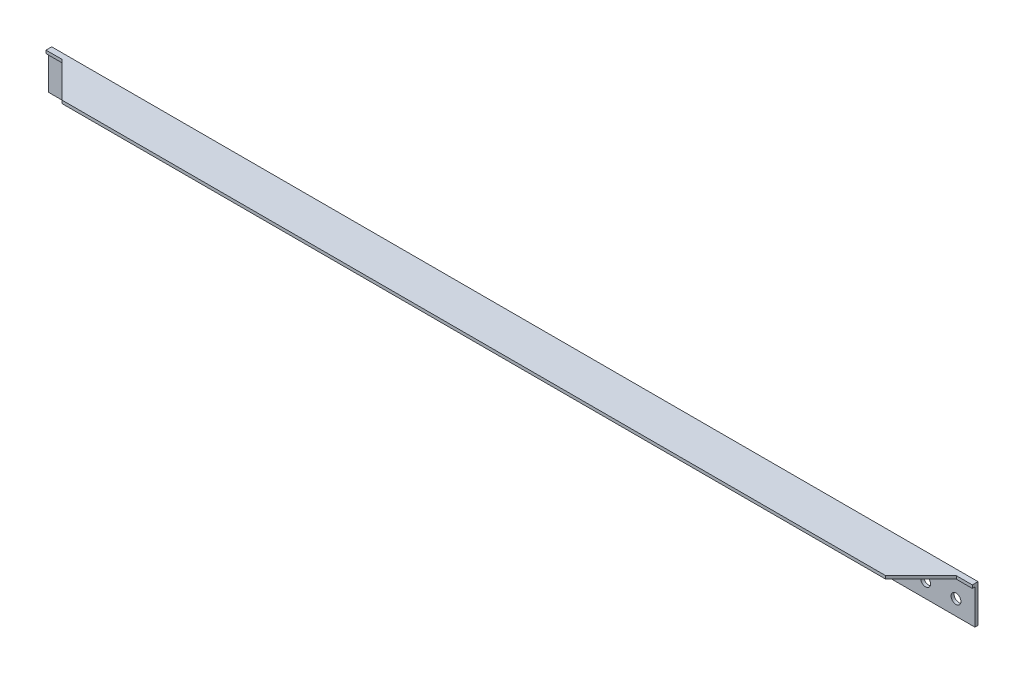
from build123d import *

# Parameters (mm, degrees)
SKETCH_1_W          = 2440
SKETCH_1_H          = 100
SKETCH_1_R          = 13
EXTRUDE_694_DEPTH   = 8
SKETCH_2_W          = 2440
SKETCH_2_H          = 8
EXTRUDE_1_DEPTH     = 100
CUT_EXTRUDE_1_DEPTH = 1229.846613699


with BuildPart() as part:
    # 草图1 → Extrude 694 (new body)
    with BuildSketch(Plane.XY):
        with Locations((0, 50)):
            Rectangle(SKETCH_1_W, SKETCH_1_H)
        with Locations((1090, 40)):
            Circle(SKETCH_1_R, mode=Mode.SUBTRACT)
        with Locations((1170, 40)):
            Circle(SKETCH_1_R, mode=Mode.SUBTRACT)
        with Locations(Location((-1170, 40, 0), (0, 0, 180))):
            Circle(SKETCH_1_R, mode=Mode.SUBTRACT)
        with Locations(Location((-1090, 40, 0), (0, 0, 180))):
            Circle(SKETCH_1_R, mode=Mode.SUBTRACT)
        with Locations((0, 40)):
            Circle(SKETCH_1_R, mode=Mode.SUBTRACT)
        with Locations((80, 40)):
            Circle(SKETCH_1_R, mode=Mode.SUBTRACT)
        with Locations((160, 40)):
            Circle(SKETCH_1_R, mode=Mode.SUBTRACT)
        with Locations(Location((-160, 40, 0), (0, 0, 180))):
            Circle(SKETCH_1_R, mode=Mode.SUBTRACT)
        with Locations(Location((-80, 40, 0), (0, 0, 180))):
            Circle(SKETCH_1_R, mode=Mode.SUBTRACT)
    extrude(amount=EXTRUDE_694_DEPTH)

    # 草图2 → 凸台-拉伸1 (add)
    with BuildSketch(Plane.XY.offset(8)):
        with Locations((0, 96)):
            Rectangle(SKETCH_2_W, SKETCH_2_H)
    extrude(amount=EXTRUDE_1_DEPTH)

    # 草图3 → 切除-拉伸1 (cut, through all)
    with BuildSketch(Plane(origin=(0, 100, 0), x_dir=(-1, 0, 0), z_dir=(0, 1, 0))):
        Polygon((-1085, 108), (-1178, 15), (-1220, 15), (-1220, 108), align=None)
        Polygon((1220, 15), (1178, 15), (1085, 108), (1220, 108), align=None)
    extrude(amount=-CUT_EXTRUDE_1_DEPTH, mode=Mode.SUBTRACT)


solid = part.part
